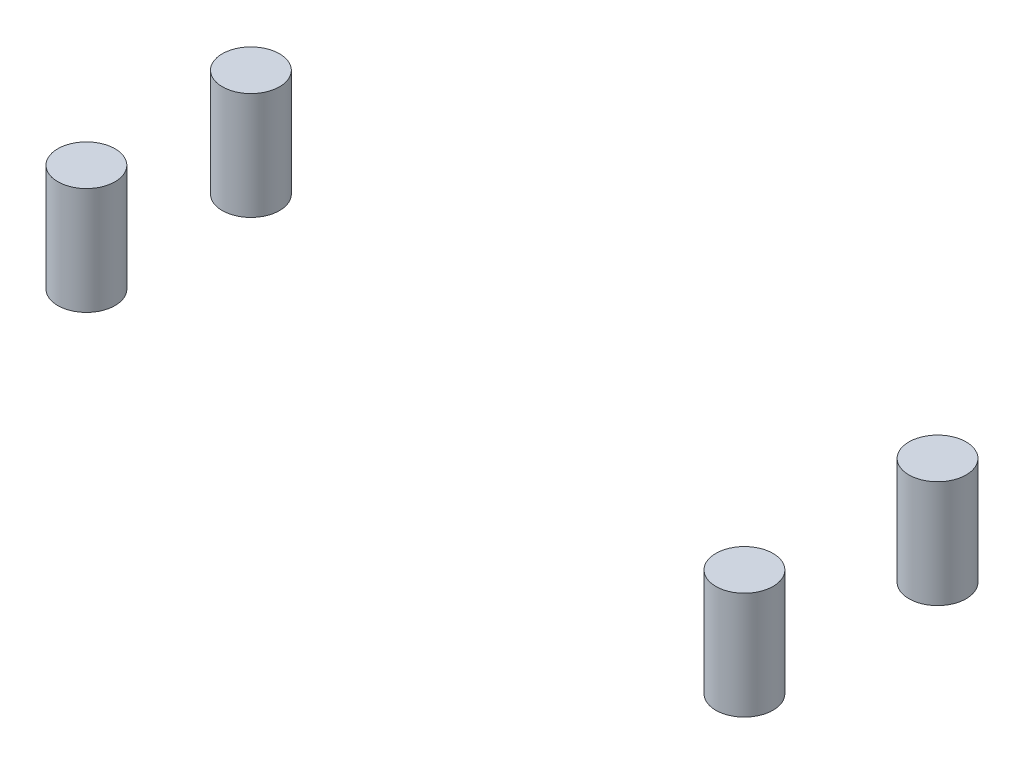
from build123d import *

# Parameters (mm, degrees)
SKETCH1_R             = 4
BOSS_EXTRUDE1_DEPTH   = 15
BOSS_EXTRUDE1_2_DEPTH = 15
BOSS_EXTRUDE1_3_DEPTH = 15
BOSS_EXTRUDE1_4_DEPTH = 15


with BuildPart() as part:
    # Sketch1 → Boss-Extrude1 (new body)
    with BuildSketch(Plane(origin=(0, 0, 0), x_dir=(1, 0, 0), z_dir=(0, 1, 0))):
        with Locations(Location((-43.699999973, 11.959999981, 0), (0, 0, 270))):
            Circle(SKETCH1_R)
    extrude(amount=BOSS_EXTRUDE1_DEPTH)


with BuildPart() as body_2:
    # Sketch1 → Boss-Extrude1 2 (new body)
    with BuildSketch(Plane(origin=(0, 0, 0), x_dir=(1, 0, 0), z_dir=(0, 1, 0))):
        with Locations(Location((-43.699999973, -11.039999993, 0), (0, 0, 270))):
            Circle(SKETCH1_R)
    extrude(amount=BOSS_EXTRUDE1_2_DEPTH)


with BuildPart() as body_3:
    # Sketch1 → Boss-Extrude1 3 (new body)
    with BuildSketch(Plane(origin=(0, 0, 0), x_dir=(1, 0, 0), z_dir=(0, 1, 0))):
        with Locations(Location((51.300000027, -14.039999993, 0), (0, 0, 270))):
            Circle(SKETCH1_R)
    extrude(amount=BOSS_EXTRUDE1_3_DEPTH)


with BuildPart() as body_4:
    # Sketch1 → Boss-Extrude1 4 (new body)
    with BuildSketch(Plane(origin=(0, 0, 0), x_dir=(1, 0, 0), z_dir=(0, 1, 0))):
        with Locations(Location((51.300000027, 12.960000007, 0), (0, 0, 270))):
            Circle(SKETCH1_R)
    extrude(amount=BOSS_EXTRUDE1_4_DEPTH)


solid = Compound([part.part, body_2.part, body_3.part, body_4.part])
